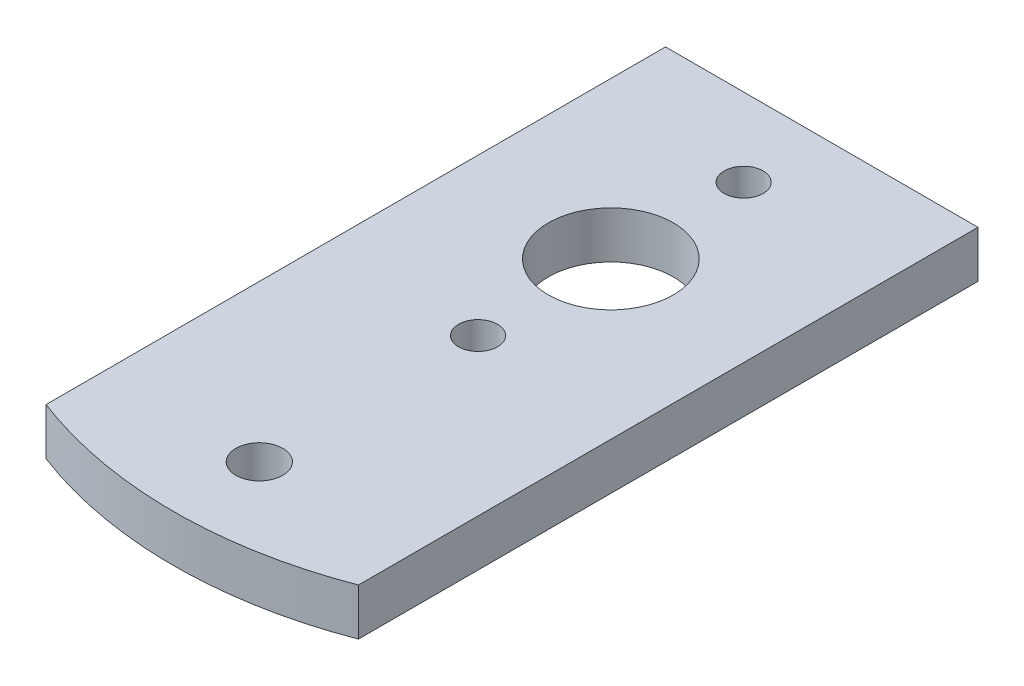
from build123d import *

# Parameters (mm, degrees)
SKETCH1_W           = 20
SKETCH1_H           = 46
SKETCH1_R           = 1.25
SKETCH1_R_2         = 4
SKETCH1_R_3         = 1.5
BOSS_EXTRUDE1_DEPTH = 3
SKETCH2_W           = 20
SKETCH2_H           = 13.653393661
CUT_EXTRUDE4_DEPTH  = 26.258661881


with BuildPart() as part:
    # Sketch1 → Boss-Extrude1 (new body)
    with BuildSketch(Plane(origin=(0, 0, 0), x_dir=(1, 0, 0), z_dir=(0, 1, 0))):
        Rectangle(SKETCH1_W, SKETCH1_H)
        with Locations(Location((0, 18, 0), (0, 0, 270))):
            Circle(SKETCH1_R, mode=Mode.SUBTRACT)
        with Locations(Location((0, 1, 0), (0, 0, 270))):
            Circle(SKETCH1_R, mode=Mode.SUBTRACT)
        with Locations(Location((0, 9.5, 0), (0, 0, 270))):
            Circle(SKETCH1_R_2, mode=Mode.SUBTRACT)
        with Locations(Location((0, -13, 0), (0, 0, 270))):
            Circle(SKETCH1_R_3, mode=Mode.SUBTRACT)
    extrude(amount=BOSS_EXTRUDE1_DEPTH)

    # Sketch2 → Cut-Extrude4 (cut, through all)
    with BuildSketch(Plane(origin=(0, 3, 0), x_dir=(1, 0, 0), z_dir=(0, 1, 0))):
        with Locations((0, -29.826696831)):
            Rectangle(SKETCH2_W, SKETCH2_H)
        with BuildLine():
            Line((10, -23), (10, -16.653393661))
            ThreePointArc((10, -16.653393661), (0, -18.5), (-10, -16.653393661))
            Line((-10, -16.653393661), (-10, -23))
            Line((-10, -23), (10, -23))
        make_face()
    extrude(amount=-CUT_EXTRUDE4_DEPTH, mode=Mode.SUBTRACT)


solid = part.part
